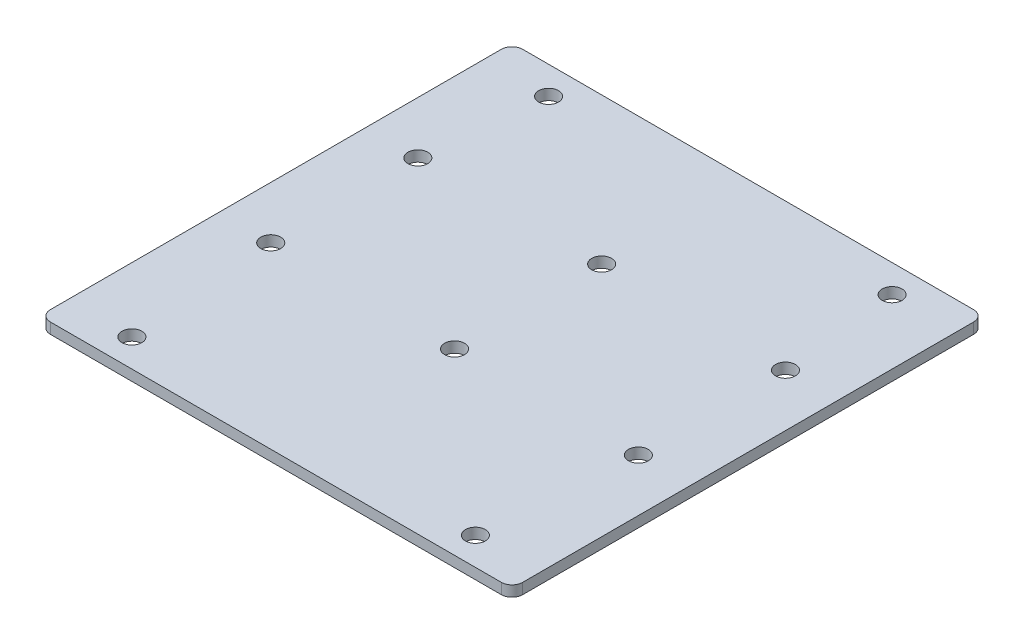
from build123d import *

# Parameters (mm, degrees)
SKETCH1_W           = 88
SKETCH1_H           = 88
BOSS_EXTRUDE1_DEPTH = 2
FILLET1_R           = 2
SKETCH2_R           = 1.85
CUT_EXTRUDE1_DEPTH  = 10
SKETCH3_R           = 1.85
CUT_EXTRUDE2_DEPTH  = 5


with BuildPart() as part:
    # Sketch1 → Boss-Extrude1 (new body)
    with BuildSketch(Plane(origin=(0, 0, 0), x_dir=(1, 0, 0), z_dir=(0, 1, 0))):
        Rectangle(SKETCH1_W, SKETCH1_H)
    extrude(amount=BOSS_EXTRUDE1_DEPTH)

    # Fillet1
    fillet1_edges = [part.edges().sort_by_distance(p)[0] for p in [
        (-44, 1, -44),
        (44, 1, -44),
        (44, 1, 44),
        (-44, 1, 44),
    ]]
    fillet(fillet1_edges, radius=FILLET1_R)

    # Sketch2 → Cut-Extrude1 (cut)
    with BuildSketch(Plane.XZ):
        with Locations(Location((-32, 38.82, 0), (0, 0, 270))):
            Circle(SKETCH2_R)
        with Locations(Location((32, 38.82, 0), (0, 0, 270))):
            Circle(SKETCH2_R)
        with Locations(Location((32, -38.82, 0), (0, 0, 270))):
            Circle(SKETCH2_R)
        with Locations(Location((-32, -38.82, 0), (0, 0, 270))):
            Circle(SKETCH2_R)
    extrude(amount=-CUT_EXTRUDE1_DEPTH, mode=Mode.SUBTRACT)

    # Sketch3 → Cut-Extrude2 (cut)
    with BuildSketch(Plane.XZ):
        with Locations(Location((-34.25, 10.7, 0), (0, 0, 270))):
            Circle(SKETCH3_R)
        with Locations(Location((0, 10.7, 0), (0, 0, 270))):
            Circle(SKETCH3_R)
        with Locations(Location((34.25, 10.7, 0), (0, 0, 270))):
            Circle(SKETCH3_R)
        with Locations(Location((34.25, -16.7, 0), (0, 0, 270))):
            Circle(SKETCH3_R)
        with Locations(Location((0, -16.7, 0), (0, 0, 270))):
            Circle(SKETCH3_R)
        with Locations(Location((-34.25, -16.7, 0), (0, 0, 270))):
            Circle(SKETCH3_R)
    extrude(amount=-CUT_EXTRUDE2_DEPTH, mode=Mode.SUBTRACT)


solid = part.part
